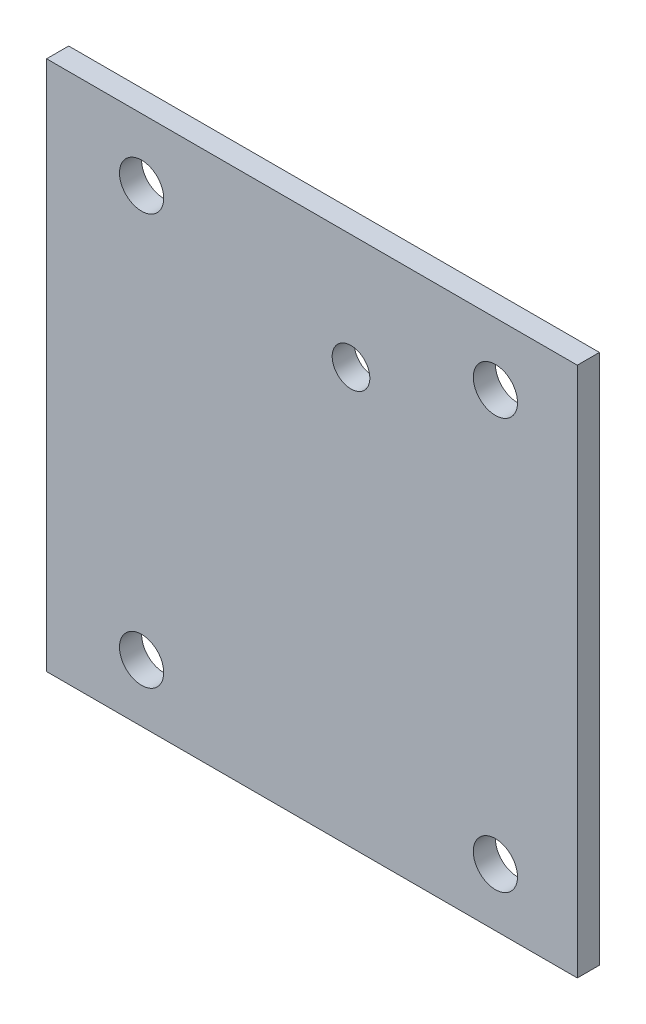
from build123d import *

# Parameters (mm, degrees)
SKETCH1_W               = 76.2
SKETCH1_H               = 76.2
SKETCH1_R               = 3.175
BOSS_EXTRUDE1_DEPTH     = 3.175
F_1_4_28_TAPPED_HOLE3_D = 5.4102


with BuildPart() as part:
    # Sketch1 → Boss-Extrude1 (new body)
    with BuildSketch(Plane.XY):
        with Locations((49.8593053, 265.676157482)):
            Rectangle(SKETCH1_W, SKETCH1_H)
        with Locations((25.4, 235.857142857)):
            Circle(SKETCH1_R, mode=Mode.SUBTRACT)
        with Locations((25.4, 294.821428571)):
            Circle(SKETCH1_R, mode=Mode.SUBTRACT)
        with Locations((76.2, 235.857142857)):
            Circle(SKETCH1_R, mode=Mode.SUBTRACT)
        with Locations((76.2, 294.821428571)):
            Circle(SKETCH1_R, mode=Mode.SUBTRACT)
    extrude(amount=BOSS_EXTRUDE1_DEPTH)

    # 1/4-28 Tapped Hole3 (through all)
    with Locations(Plane.XY.offset(3.175)):
        with Locations((55.4677219, 287.273383219)):
            Hole(F_1_4_28_TAPPED_HOLE3_D / 2)


solid = part.part
